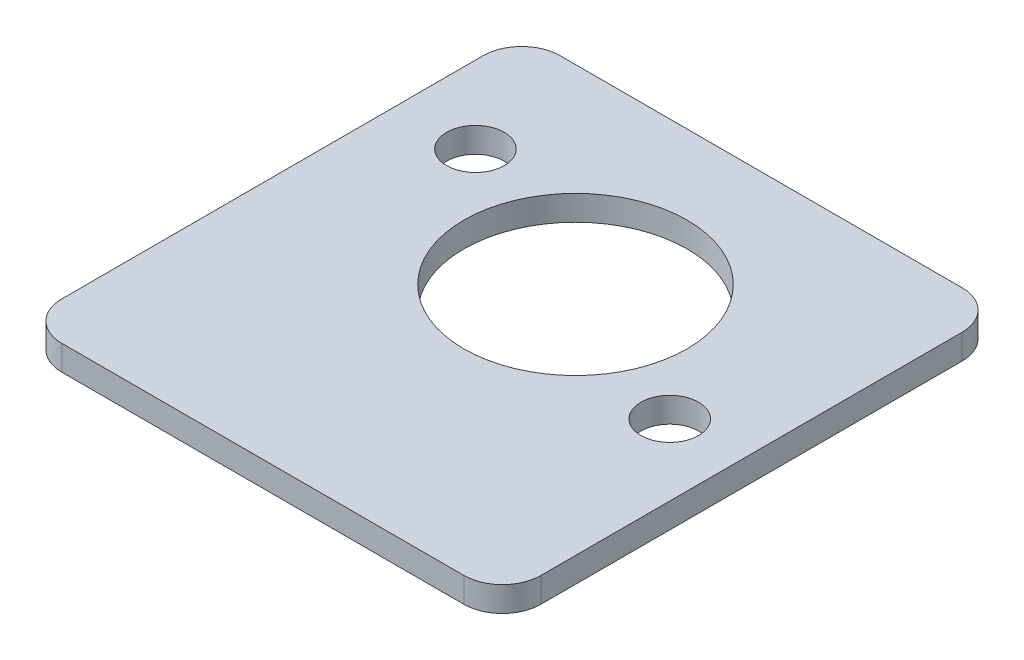
from build123d import *

# Parameters (mm, degrees)
SKETCH1_W           = 63.246
SKETCH1_H           = 65.786
BOSS_EXTRUDE1_DEPTH = 3.302
FILLET2_R           = 5.08
SKETCH2_R           = 14.732
SKETCH2_R_2         = 3.81
CUT_EXTRUDE1_DEPTH  = 9.652


with BuildPart() as part:
    # Sketch1 → Boss-Extrude1 (new body)
    with BuildSketch(Plane(origin=(0, 0, 0), x_dir=(1, 0, 0), z_dir=(0, 1, 0))):
        with Locations((-31.623, 32.893)):
            Rectangle(SKETCH1_W, SKETCH1_H)
    extrude(amount=BOSS_EXTRUDE1_DEPTH)

    # Fillet2
    fillet2_edges = [part.edges().sort_by_distance(p)[0] for p in [
        (0, 1.651, 0),
        (-63.246, 1.651, 0),
        (-63.246, 1.651, -65.786),
        (0, 1.651, -65.786),
    ]]
    fillet(fillet2_edges, radius=FILLET2_R)

    # Sketch2 → Cut-Extrude1 (cut)
    with BuildSketch(Plane(origin=(0, 3.302, 0), x_dir=(1, 0, 0), z_dir=(0, 1, 0))):
        with Locations(Location((-30.988, 40.64, 0), (0, 0, 270))):
            Circle(SKETCH2_R)
        with Locations(Location((-53.086, 49.53, 0), (0, 0, 270))):
            Circle(SKETCH2_R_2)
        with Locations(Location((-9.398, 31.496, 0), (0, 0, 270))):
            Circle(SKETCH2_R_2)
    extrude(amount=-CUT_EXTRUDE1_DEPTH, mode=Mode.SUBTRACT)


solid = part.part
